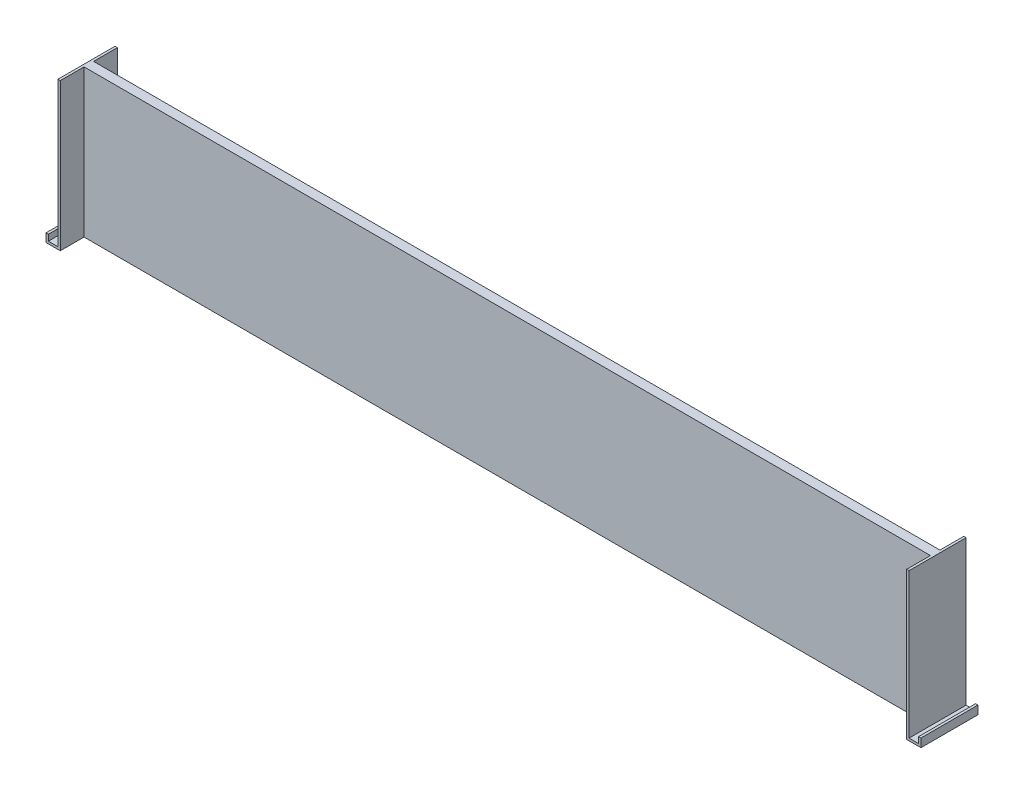
from build123d import *

# Parameters (mm, degrees)
SKETCH1_W           = 282.575
SKETCH1_H           = 3.175
SKETCH1_W_2         = 4.7625
SKETCH1_H_2         = 19.05
BOSS_EXTRUDE1_DEPTH = 49.2125
CUT_EXTRUDE1_DEPTH  = 293.143135402


with BuildPart() as part:
    # Sketch1 → Boss-Extrude1 (new body)
    with BuildSketch(Plane(origin=(0, 0, 0), x_dir=(1, 0, 0), z_dir=(0, 1, 0))):
        with Locations((141.2875, 1.5875)):
            Rectangle(SKETCH1_W, SKETCH1_H)
        with Locations((-2.38125, 1.5875)):
            Rectangle(SKETCH1_W_2, SKETCH1_H_2)
        with Locations((284.95625, 1.5875)):
            Rectangle(SKETCH1_W_2, SKETCH1_H_2)
    extrude(amount=BOSS_EXTRUDE1_DEPTH)

    # Sketch2 → Cut-Extrude1 (cut, through all)
    with BuildSketch(Plane.XY.offset(7.9375)):
        Polygon((-4.7625, 2.81851333), (-3.96875, 2.81851333), (-3.96875, 0.79375), (-0.79375, 0.79375), (-0.79375, 49.2125), (-4.7625, 49.2125), align=None)
        Polygon((287.3375, 2.81851333), (286.54375, 2.81851333), (286.54375, 0.79375), (283.36875, 0.79375), (283.36875, 49.2125), (287.3375, 49.2125), align=None)
    extrude(amount=-CUT_EXTRUDE1_DEPTH, mode=Mode.SUBTRACT)


solid = part.part
